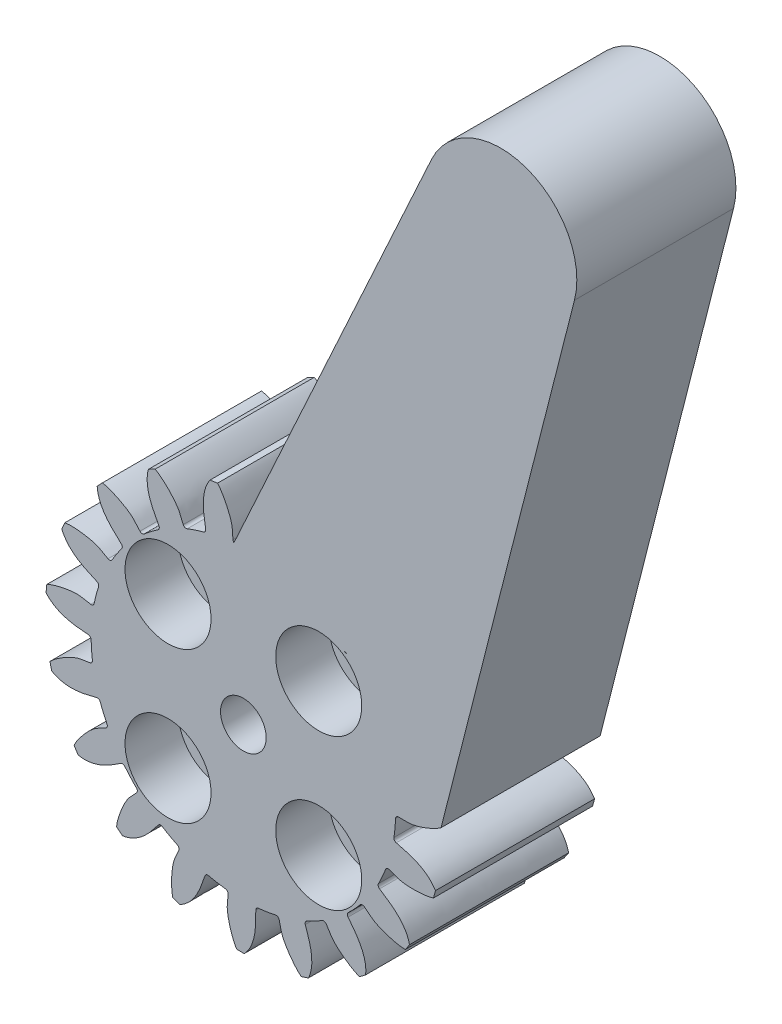
from build123d import *

# Parameters (mm, degrees)
SKETCH_3_R               = 13
SKETCH_3_R_2             = 10
EXTRUDE_1_DEPTH          = 4
CUT_EXTRUDE_2_DEPTH      = 19.814887722
PATTERN_CIRCULAR_4_COUNT = 19
CUT_EXTRUDE_4_DEPTH      = 19.804447773
CUT_EXTRUDE_4_DEPTH_BACK = 19.804447773
SKETCH_8_R               = 1.5
SKETCH_13_R              = 1.5
EXTRUDE_6_DEPTH          = 6.45
SKETCH_14_R              = 2.825
CUT_EXTRUDE_5_DEPTH      = 3.5
EXTRUDE_7_DEPTH          = 10.45


with BuildPart() as part:
    # 草图3 → 凸台-拉伸1 (new body)
    # profile 1 of 2: a face of its own
    with BuildSketch(Plane.XY):
        Circle(SKETCH_3_R)
        Circle(SKETCH_3_R_2, mode=Mode.SUBTRACT)
    # profile 2 of 2: a face of its own
    with BuildSketch(Plane.XY):
        Circle(SKETCH_3_R_2)
    extrude(amount=EXTRUDE_1_DEPTH)

    # 草图6 → 切除-拉伸2 (cut, symmetric)
    with BuildSketch(Plane.XY.offset(4)):
        with BuildLine():
            Line((-1.696840499, 12.888783198), (-1.873622587, 14.231576474))
            Line((-1.873622587, 14.231576474), (3.000861464, 14.403965519))
            Line((3.000861464, 14.403965519), (2.084995297, 12.83171051))
            add(Edge.make_bspline(
                [(2.084995297, 12.83171051), (1.471750903, 12.385409064), (1.073531879, 11.424223458), (0.908091171, 10.424013275), (0.866775265, 10.148389403)],
                knots=[0, 0, 0, 0, 0.67611985, 0.94077492, 0.94077492, 0.94077492, 0.94077492], degree=3))
            ThreePointArc((0.866775265, 10.148389403), (0.794461275, 10.022295574), (0.655867727, 9.978468696))
            ThreePointArc((0.655867727, 9.978468696), (0.089873577, 9.999596129), (-0.476408885, 9.988645282))
            ThreePointArc((-0.476408885, 9.988645282), (-0.618800498, 10.03892803), (-0.685447576, 10.174434093))
            add(Edge.make_bspline(
                [(-1.696840499, 12.888783198), (-1.34037548, 12.491366053), (-0.721854022, 11.223575025), (-0.721476087, 10.688451407), (-0.685447576, 10.174434093)],
                knots=[0, 0, 0, 0, 0.6442443, 0.94077492, 0.94077492, 0.94077492, 0.94077492], degree=3))
        make_face()
    cut_extrude_2 = extrude(amount=CUT_EXTRUDE_2_DEPTH, both=True, mode=Mode.SUBTRACT)

    # 阵列(圆周)4: 切除-拉伸2 ×19 about axis
    pattern_circular_4_axis = Axis((0, 0, 4), (0, 0, 1))
    for i in range(1, PATTERN_CIRCULAR_4_COUNT):
        add(cut_extrude_2.rotate(pattern_circular_4_axis, i * 360 / PATTERN_CIRCULAR_4_COUNT), mode=Mode.SUBTRACT)

    # 草图8 → 切除-拉伸4 (cut, two sides: drawn at the far end of the back side and taken through both)
    with BuildSketch(Plane(origin=(0, 0, 0), x_dir=(-1, 0, 0), z_dir=(0, 0, -1)).offset(-CUT_EXTRUDE_4_DEPTH_BACK)):
        Circle(SKETCH_8_R)
        with Locations((-4.949747468, 4.949747468)):
            Circle(SKETCH_8_R)
        with Locations((-4.949747468, -4.949747468)):
            Circle(SKETCH_8_R)
        with Locations((4.949747468, -4.949747468)):
            Circle(SKETCH_8_R)
        with Locations((4.949747468, 4.949747468)):
            Circle(SKETCH_8_R)
    extrude(amount=CUT_EXTRUDE_4_DEPTH + CUT_EXTRUDE_4_DEPTH_BACK, mode=Mode.SUBTRACT)

    # 草图13 → 凸台-拉伸6 (add)
    with BuildSketch(Plane(origin=(0, 0, 0), x_dir=(-1, 0, 0), z_dir=(0, 0, -1))):
        with BuildLine():
            ThreePointArc((2.475365662, 9.879963141), (2.502818882, 9.73722111), (2.619672484, 9.650767642))
            ThreePointArc((2.619672484, 9.650767642), (3.161859577, 9.486972331), (3.693903558, 9.292743217))
            ThreePointArc((3.693903558, 9.292743217), (3.844906783, 9.294067025), (3.951941485, 9.400590726))
            add(Edge.make_bspline(
                [(5.789882063, 11.639470164), (5.323690166, 11.379330179), (4.327030833, 10.381065154), (4.152919021, 9.875058725), (3.951941485, 9.400590726)],
                knots=[0, 0, 0, 0, 0.6442443, 0.94077492, 0.94077492, 0.94077492, 0.94077492], degree=3))
            ThreePointArc((5.789882063, 11.639470164), (6.014090471, 11.525220857), (6.23604547, 11.406653186))
            add(Edge.make_bspline(
                [(5.54926231, 8.540889569), (5.685949941, 8.783772287), (6.169735786, 9.674694447), (6.445857441, 10.677796132), (6.23604547, 11.406653186)],
                knots=[0, 0, 0, 0, 0.26465507, 0.94077492, 0.94077492, 0.94077492, 0.94077492], degree=3))
            ThreePointArc((5.54926231, 8.540889569), (5.528879777, 8.39696765), (5.611330534, 8.277256166))
            ThreePointArc((5.611330534, 8.277256166), (6.070956184, 7.946287876), (6.511106465, 7.589828233))
            ThreePointArc((6.511106465, 7.589828233), (6.654357758, 7.542049646), (6.790181214, 7.608047488))
            add(Edge.make_bspline(
                [(9.255500067, 9.128839932), (8.730100418, 9.034167311), (7.463306713, 8.413605795), (7.13432874, 7.991550203), (6.790181214, 7.608047488)],
                knots=[0, 0, 0, 0, 0.6442443, 0.94077492, 0.94077492, 0.94077492, 0.94077492], degree=3))
            ThreePointArc((9.255500067, 9.128839932), (9.430463555, 8.947980617), (9.60189356, 8.763768599))
            add(Edge.make_bspline(
                [(8.021810282, 6.276278088), (8.229955689, 6.461618348), (8.976810635, 7.147182881), (9.563677842, 8.006277195), (9.60189356, 8.763768599)],
                knots=[0, 0, 0, 0, 0.26465507, 0.94077492, 0.94077492, 0.94077492, 0.94077492], degree=3))
            ThreePointArc((8.021810282, 6.276278088), (7.955800759, 6.146772452), (7.994913852, 6.00677555))
            ThreePointArc((7.994913852, 6.00677555), (8.322170488, 5.54449983), (8.622729956, 5.064437591))
            ThreePointArc((8.622729956, 5.064437591), (8.742705817, 4.972734162), (8.892599447, 4.991054254))
            add(Edge.make_bspline(
                [(11.718141024, 5.628958246), (11.190468827, 5.710012235), (9.790817505, 5.534401698), (9.342623239, 5.242033215), (8.892599447, 4.991054254)],
                knots=[0, 0, 0, 0, 0.6442443, 0.94077492, 0.94077492, 0.94077492, 0.94077492], degree=3))
            ThreePointArc((11.718141024, 5.628958246), (11.824899585, 5.401087836), (11.927227495, 5.171193701))
            add(Edge.make_bspline(
                [(9.625070638, 3.331534489), (9.882118037, 3.439247799), (10.811108762, 3.84516315), (11.645125353, 4.467153894), (11.927227495, 5.171193701)],
                knots=[0, 0, 0, 0, 0.26465507, 0.94077492, 0.94077492, 0.94077492, 0.94077492], degree=3))
            ThreePointArc((9.625070638, 3.331534489), (9.520587282, 3.230479082), (9.512124199, 3.085367598))
            ThreePointArc((9.512124199, 3.085367598), (9.671548488, 2.541879196), (9.79994686, 1.990236553))
            ThreePointArc((9.79994686, 1.990236553), (9.883646043, 1.86454577), (10.031366548, 1.833202847))
            add(Edge.make_bspline(
                [(12.910939576, 1.519091591), (12.438176302, 1.767088734), (11.0573413, 2.055459301), (10.538499545, 1.924460589), (10.031366548, 1.833202847)],
                knots=[0, 0, 0, 0, 0.6442443, 0.94077492, 0.94077492, 0.94077492, 0.94077492], degree=3))
            ThreePointArc((12.910939576, 1.519091591), (12.937924262, 1.26890338), (12.96006126, 1.018239726))
            add(Edge.make_bspline(
                [(10.185305242, 0.025767433), (10.463399559, 0.044181386), (11.473855503, 0.126460328), (12.464642839, 0.443945154), (12.96006126, 1.018239726)],
                knots=[0, 0, 0, 0, 0.26465507, 0.94077492, 0.94077492, 0.94077492, 0.94077492], degree=3))
            ThreePointArc((10.185305242, 0.025767433), (10.053670446, -0.035886822), (9.998548294, -0.170387807))
            ThreePointArc((9.998548294, -0.170387807), (9.972864139, -0.736193491), (9.915187461, -1.299637496))
            ThreePointArc((9.915187461, -1.299637496), (9.953539861, -1.445695087), (10.08307943, -1.523304533))
            add(Edge.make_bspline(
                [(12.704637491, -2.755392209), (12.338014375, -2.367326251), (11.125630593, -1.646224004), (10.592365903, -1.601657202), (10.08307943, -1.523304533)],
                knots=[0, 0, 0, 0, 0.6442443, 0.94077492, 0.94077492, 0.94077492, 0.94077492], degree=3))
            ThreePointArc((12.704637491, -2.755392209), (12.648924093, -3.000786445), (12.588471292, -3.245056323))
            add(Edge.make_bspline(
                [(9.641803982, -3.282791923), (9.910809382, -3.355672766), (10.893231964, -3.605946433), (11.933422864, -3.627371933), (12.588471292, -3.245056323)],
                knots=[0, 0, 0, 0, 0.26465507, 0.94077492, 0.94077492, 0.94077492, 0.94077492], degree=3))
            ThreePointArc((9.641803982, -3.282791923), (9.497282418, -3.298363832), (9.401474538, -3.40767905))
            ThreePointArc((9.401474538, -3.40767905), (9.193465217, -3.934488189), (8.95596365, -4.448675658))
            ThreePointArc((8.95596365, -4.448675658), (8.944813189, -4.599272449), (9.042134201, -4.714738231))
            add(Edge.make_bspline(
                [(11.121590801, -6.731286508), (10.900837147, -6.245204703), (9.988285179, -5.169513395), (9.498385058, -4.954210583), (9.042134201, -4.714738231)],
                knots=[0, 0, 0, 0, 0.6442443, 0.94077492, 0.94077492, 0.94077492, 0.94077492], degree=3))
            ThreePointArc((11.121590801, -6.731286508), (10.98921673, -6.945294498), (10.852725129, -7.156700167))
            add(Edge.make_bspline(
                [(8.053463652, -6.235609836), (8.284229227, -6.391887706), (9.132157717, -6.947592946), (10.109031356, -7.305606986), (10.852725129, -7.156700167)],
                knots=[0, 0, 0, 0, 0.26465507, 0.94077492, 0.94077492, 0.94077492, 0.94077492], degree=3))
            ThreePointArc((8.053463652, -6.235609836), (7.911716475, -6.203411942), (7.785605137, -6.275695392))
            ThreePointArc((7.785605137, -6.275695392), (7.417811686, -6.706420043), (7.026222211, -7.115630783))
            ThreePointArc((7.026222211, -7.115630783), (6.966777215, -7.254447276), (7.021333428, -7.395256884))
            add(Edge.make_bspline(
                [(8.333347178, -9.977741468), (8.282385071, -9.446318322), (7.768554082, -8.132605796), (7.37510681, -7.769898375), (7.021333428, -7.395256884)],
                knots=[0, 0, 0, 0, 0.6442443, 0.94077492, 0.94077492, 0.94077492, 0.94077492], degree=3))
            ThreePointArc((8.333347178, -9.977741468), (8.138657219, -10.137172124), (7.940917801, -10.2928045))
            add(Edge.make_bspline(
                [(5.592405573, -8.512702669), (5.759924291, -8.735442432), (6.381472481, -9.53635996), (7.189169443, -10.192166164), (7.940917801, -10.2928045)],
                knots=[0, 0, 0, 0, 0.26465507, 0.94077492, 0.94077492, 0.94077492, 0.94077492], degree=3))
            ThreePointArc((5.592405573, -8.512702669), (5.468793288, -8.436224112), (5.326044613, -8.463642761))
            ThreePointArc((5.326044613, -8.463642761), (4.838323161, -8.751607223), (4.335080573, -9.011496903))
            ThreePointArc((4.335080573, -9.011496903), (4.233782829, -9.123490176), (4.239662231, -9.274384705))
            add(Edge.make_bspline(
                [(4.642056084, -12.142953319), (4.766408057, -11.623776776), (4.706979609, -10.214404169), (4.452621302, -9.743597116), (4.239662231, -9.274384705)],
                knots=[0, 0, 0, 0, 0.6442443, 0.94077492, 0.94077492, 0.94077492, 0.94077492], degree=3))
            ThreePointArc((4.642056084, -12.142953319), (4.406147914, -12.230529856), (4.168588813, -12.313523757))
            add(Edge.make_bspline(
                [(2.525323576, -9.867312079), (2.611442185, -10.132376426), (2.939255683, -11.0917144), (3.490249469, -11.97424599), (4.168588813, -12.313523757)],
                knots=[0, 0, 0, 0, 0.26465507, 0.94077492, 0.94077492, 0.94077492, 0.94077492], degree=3))
            ThreePointArc((2.525323576, -9.867312079), (2.433241492, -9.754840498), (2.289324513, -9.734423109))
            ThreePointArc((2.289324513, -9.734423109), (1.734527246, -9.848421967), (1.174165689, -9.930827505))
            ThreePointArc((1.174165689, -9.930827505), (1.04199238, -10.00386135), (0.998557846, -10.148489036))
            add(Edge.make_bspline(
                [(0.447726184, -12.992287761), (0.733916772, -12.541618654), (1.135330859, -11.189313357), (1.047625186, -10.661425922), (0.998557846, -10.148489036)],
                knots=[0, 0, 0, 0, 0.6442443, 0.94077492, 0.94077492, 0.94077492, 0.94077492], degree=3))
            ThreePointArc((0.447726184, -12.992287761), (0.196164114, -12.998519902), (-0.055471455, -12.99988165))
            add(Edge.make_bspline(
                [(-0.815416416, -10.152645118), (-0.820030203, -10.431310214), (-0.821475076, -11.44510948), (-0.586893191, -12.458730464), (-0.055471455, -12.99988165)],
                knots=[0, 0, 0, 0, 0.26465507, 0.94077492, 0.94077492, 0.94077492, 0.94077492], degree=3))
            ThreePointArc((-0.815416416, -10.152645118), (-0.865989775, -10.016368554), (-0.99547942, -9.950327669))
            ThreePointArc((-0.99547942, -9.950327669), (-1.55723161, -9.878007376), (-2.113988266, -9.773998855))
            ThreePointArc((-2.113988266, -9.773998855), (-2.262714112, -9.800158922), (-2.350755776, -9.922847111))
            add(Edge.make_bspline(
                [(-3.795121796, -12.433706228), (-3.378105783, -12.100381549), (-2.559348607, -10.951686823), (-2.470897374, -10.4239238), (-2.350755776, -9.922847111)],
                knots=[0, 0, 0, 0, 0.6442443, 0.94077492, 0.94077492, 0.94077492, 0.94077492], degree=3))
            ThreePointArc((-3.795121796, -12.433706228), (-4.035077111, -12.357918624), (-4.27352053, -12.277500653))
            add(Edge.make_bspline(
                [(-4.067793386, -9.337781524), (-4.162639595, -9.599849683), (-4.493186263, -10.558249358), (-4.600436868, -11.593118175), (-4.27352053, -12.277500653)],
                knots=[0, 0, 0, 0, 0.26465507, 0.94077492, 0.94077492, 0.94077492, 0.94077492], degree=3))
            ThreePointArc((-4.067793386, -9.337781524), (-4.071377613, -9.192467657), (-4.172407712, -9.087959831))
            ThreePointArc((-4.172407712, -9.087959831), (-4.680240257, -8.837157412), (-5.173058791, -8.558005769))
            ThreePointArc((-5.173058791, -8.558005769), (-5.32222042, -8.534457208), (-5.445328533, -8.621910731))
            add(Edge.make_bspline(
                [(-7.626709441, -10.527739696), (-7.12405816, -10.347880345), (-5.976682938, -9.527275089), (-5.721659864, -9.05682779), (-5.445328533, -8.621910731)],
                knots=[0, 0, 0, 0, 0.6442443, 0.94077492, 0.94077492, 0.94077492, 0.94077492], degree=3))
            ThreePointArc((-7.626709441, -10.527739696), (-7.829055121, -10.37814511), (-8.028467345, -10.224661955))
            add(Edge.make_bspline(
                [(-6.879361825, -7.511024412), (-7.054162396, -7.728096481), (-7.677991, -8.52723909), (-8.115451827, -9.471211646), (-8.028467345, -10.224661955)],
                knots=[0, 0, 0, 0, 0.26465507, 0.94077492, 0.94077492, 0.94077492, 0.94077492], degree=3))
            ThreePointArc((-6.879361825, -7.511024412), (-6.835568513, -7.372420254), (-6.897190887, -7.24077053))
            ThreePointArc((-6.897190887, -7.24077053), (-7.296072252, -6.838664321), (-7.671548128, -6.414619967))
            ThreePointArc((-7.671548128, -6.414619967), (-7.804981563, -6.343914631), (-7.949815452, -6.386656542))
            add(Edge.make_bspline(
                [(-10.631824778, -7.480929213), (-10.098008294, -7.474025743), (-8.746350935, -7.070435268), (-8.352391726, -6.708283958), (-7.949815452, -6.386656542)],
                knots=[0, 0, 0, 0, 0.6442443, 0.94077492, 0.94077492, 0.94077492, 0.94077492], degree=3))
            ThreePointArc((-10.631824778, -7.480929213), (-10.774633528, -7.27373854), (-10.913405149, -7.063822482))
            add(Edge.make_bspline(
                [(-8.945444665, -4.870331258), (-9.181257245, -5.018884111), (-10.030766276, -5.572170153), (-10.751031656, -6.322952374), (-10.913405149, -7.063822482)],
                knots=[0, 0, 0, 0, 0.26465507, 0.94077492, 0.94077492, 0.94077492, 0.94077492], degree=3))
            ThreePointArc((-8.945444665, -4.870331258), (-8.8590195, -4.753456721), (-8.874556408, -4.608931391))
            ThreePointArc((-8.874556408, -4.608931391), (-9.121261608, -4.099095838), (-9.338706188, -3.576110559))
            ThreePointArc((-9.338706188, -3.576110559), (-9.441951847, -3.465910467), (-9.592816512, -3.459309017))
            add(Edge.make_bspline(
                [(-12.48481693, -3.623443971), (-11.977682543, -3.790244479), (-10.568216095, -3.847404077), (-10.078012345, -3.63279347), (-9.592816512, -3.459309017)],
                knots=[0, 0, 0, 0, 0.6442443, 0.94077492, 0.94077492, 0.94077492, 0.94077492], degree=3))
            ThreePointArc((-12.48481693, -3.623443971), (-12.552613207, -3.381109535), (-12.615706166, -3.137508236))
            add(Edge.make_bspline(
                [(-10.042149774, -1.701862142), (-10.31342041, -1.765797772), (-11.296552383, -2.013270119), (-12.221570386, -2.489503102), (-12.615706166, -3.137508236)],
                knots=[0, 0, 0, 0, 0.26465507, 0.94077492, 0.94077492, 0.94077492, 0.94077492], degree=3))
            ThreePointArc((-10.042149774, -1.701862142), (-9.922458262, -1.619382395), (-9.890226039, -1.47764302))
            ThreePointArc((-9.890226039, -1.47764302), (-9.958020737, -0.915326716), (-9.993870528, -0.350074083))
            ThreePointArc((-9.993870528, -0.350074083), (-10.055740141, -0.212321125), (-10.196287055, -0.157091683))
            add(Edge.make_bspline(
                [(-12.984885446, 0.626697648), (-12.559389035, 0.304268585), (-11.244851058, -0.207446955), (-10.711523949, -0.16363344), (-10.196287055, -0.157091683)],
                knots=[0, 0, 0, 0, 0.6442443, 0.94077492, 0.94077492, 0.94077492, 0.94077492], degree=3))
            ThreePointArc((-12.984885446, 0.626697648), (-12.97032247, 0.877915151), (-12.950899667, 1.12880371))
            add(Edge.make_bspline(
                [(-10.050632134, 1.651030144), (-10.327964444, 1.678640154), (-11.338181754, 1.763798972), (-12.367712328, 1.61372246), (-12.950899667, 1.12880371)],
                knots=[0, 0, 0, 0, 0.26465507, 0.94077492, 0.94077492, 0.94077492, 0.94077492], degree=3))
            ThreePointArc((-10.050632134, 1.651030144), (-9.910644708, 1.69017714), (-9.834136216, 1.8137709))
            ThreePointArc((-9.834136216, 1.8137709), (-9.715673805, 2.367632258), (-9.566043926, 2.913898353))
            ThreePointArc((-9.566043926, 2.913898353), (-9.57983296, 3.064276505), (-9.694831684, 3.162148972))
            add(Edge.make_bspline(
                [(-12.077840143, 4.808926853), (-11.780090846, 4.365809427), (-10.702931927, 3.454990263), (-10.184275727, 3.323258811), (-9.694831684, 3.162148972)],
                knots=[0, 0, 0, 0, 0.6442443, 0.94077492, 0.94077492, 0.94077492, 0.94077492], degree=3))
            ThreePointArc((-12.077840143, 4.808926853), (-11.982496039, 5.041804108), (-11.882662235, 5.272792259))
            add(Edge.make_bspline(
                [(-8.969972551, 4.825007696), (-9.223313276, 4.941171373), (-10.151143203, 5.349733076), (-11.173620733, 5.542076154), (-11.882662235, 5.272792259)],
                knots=[0, 0, 0, 0, 0.26465507, 0.94077492, 0.94077492, 0.94077492, 0.94077492], degree=3))
            ThreePointArc((-8.969972551, 4.825007696), (-8.824859021, 4.816579757), (-8.712365142, 4.908634599))
            ThreePointArc((-8.712365142, 4.908634599), (-8.420482862, 5.394021539), (-8.101588032, 5.862104687))
            ThreePointArc((-8.101588032, 5.862104687), (-8.065802231, 6.008812229), (-8.142790869, 6.138721721))
            add(Edge.make_bspline(
                [(-9.861973453, 8.470034215), (-9.724237028, 7.954247075), (-9.001184049, 6.743025677), (-8.553403205, 6.450024405), (-8.142790869, 6.138721721)],
                knots=[0, 0, 0, 0, 0.6442443, 0.94077492, 0.94077492, 0.94077492, 0.94077492], degree=3))
            ThreePointArc((-9.861973453, 8.470034215), (-9.696180235, 8.659335359), (-9.526753972, 8.845391951))
            add(Edge.make_bspline(
                [(-6.917277258, 7.476120796), (-7.119173, 7.668250004), (-7.864070774, 8.355940591), (-8.768693956, 8.869859903), (-9.526753972, 8.845391951)],
                knots=[0, 0, 0, 0, 0.26465507, 0.94077492, 0.94077492, 0.94077492, 0.94077492], degree=3))
            ThreePointArc((-6.917277258, 7.476120796), (-6.782762927, 7.42103122), (-6.646474119, 7.471571574))
            ThreePointArc((-6.646474119, 7.471571574), (-6.212801944, 7.83588489), (-5.759199365, 8.17506102))
            ThreePointArc((-5.759199365, 8.17506102), (-5.677716677, 8.302199912), (-5.708352315, 8.450068718))
            add(Edge.make_bspline(
                [(-6.577408916, 11.213281944), (-6.61461124, 10.68071863), (-6.324018211, 9.300349629), (-5.995636726, 8.877829772), (-5.708352315, 8.450068718)],
                knots=[0, 0, 0, 0, 0.6442443, 0.94077492, 0.94077492, 0.94077492, 0.94077492], degree=3))
            ThreePointArc((-6.577408916, 11.213281944), (-6.35913285, 11.338493259), (-6.138474093, 11.459456174))
            add(Edge.make_bspline(
                [(-4.114987643, 9.317080204), (-4.243559864, 9.564354762), (-4.724804254, 10.456652288), (-5.413543129, 11.236456701), (-6.138474093, 11.459456174)],
                knots=[0, 0, 0, 0, 0.26465507, 0.94077492, 0.94077492, 0.94077492, 0.94077492], degree=3))
            ThreePointArc((-4.114987643, 9.317080204), (-4.005649225, 9.221298802), (-3.860334494, 9.224847836))
            ThreePointArc((-3.860334494, 9.224847836), (-3.331867534, 9.428608526), (-2.792712084, 9.602122641))
            ThreePointArc((-2.792712084, 9.602122641), (-2.674362422, 9.695915412), (-2.655325214, 9.845719654))
            add(Edge.make_bspline(
                [(-2.580080063, 12.741396582), (-2.788189688, 12.249768592), (-2.961546873, 10.84983639), (-2.788149975, 10.34358453), (-2.655325214, 9.845719654)],
                knots=[0, 0, 0, 0, 0.6442443, 0.94077492, 0.94077492, 0.94077492, 0.94077492], degree=3))
            ThreePointArc((-2.580080063, 12.741396582), (-2.332974749, 12.788949481), (-2.084995297, 12.83171051))
            add(Edge.make_bspline(
                [(-0.866775265, 10.148389403), (-0.908091171, 10.424013275), (-1.073531879, 11.424223458), (-1.471750903, 12.385409064), (-2.084995297, 12.83171051)],
                knots=[0, 0, 0, 0, 0.26465507, 0.94077492, 0.94077492, 0.94077492, 0.94077492], degree=3))
            ThreePointArc((-0.866775265, 10.148389403), (-0.794461275, 10.022295574), (-0.655867727, 9.978468696))
            ThreePointArc((-0.655867727, 9.978468696), (-0.089873577, 9.999596129), (0.476408885, 9.988645282))
            ThreePointArc((0.476408885, 9.988645282), (0.618800498, 10.03892803), (0.685447576, 10.174434093))
            add(Edge.make_bspline(
                [(1.696840499, 12.888783198), (1.34037548, 12.491366053), (0.721854022, 11.223575025), (0.721476087, 10.688451407), (0.685447576, 10.174434093)],
                knots=[0, 0, 0, 0, 0.6442443, 0.94077492, 0.94077492, 0.94077492, 0.94077492], degree=3))
            ThreePointArc((1.696840499, 12.888783198), (1.945997366, 12.853524585), (2.194425091, 12.813449907))
            add(Edge.make_bspline(
                [(2.475365662, 9.879963141), (2.525783291, 10.154068204), (2.694074332, 11.153802751), (2.629528369, 12.192210175), (2.194425091, 12.813449907)],
                knots=[0, 0, 0, 0, 0.26465507, 0.94077492, 0.94077492, 0.94077492, 0.94077492], degree=3))
        make_face()
        with Locations((-4.949747468, -4.949747468)):
            Circle(SKETCH_13_R, mode=Mode.SUBTRACT)
        with Locations((4.949747468, -4.949747468)):
            Circle(SKETCH_13_R, mode=Mode.SUBTRACT)
        with Locations((4.949747468, 4.949747468)):
            Circle(SKETCH_13_R, mode=Mode.SUBTRACT)
        Circle(SKETCH_13_R, mode=Mode.SUBTRACT)
        with Locations((-4.949747468, 4.949747468)):
            Circle(SKETCH_13_R, mode=Mode.SUBTRACT)
    extrude(amount=EXTRUDE_6_DEPTH)

    # 草图14 → 切除-拉伸5 (cut)
    with BuildSketch(Plane.XY.offset(4)):
        with Locations((4.949747468, -4.949747468)):
            Circle(SKETCH_14_R)
        with Locations((-4.949747468, -4.949747468)):
            Circle(SKETCH_14_R)
        with Locations((-4.949747468, 4.949747468)):
            Circle(SKETCH_14_R)
        with Locations((4.949747468, 4.949747468)):
            Circle(SKETCH_14_R)
    extrude(amount=-CUT_EXTRUDE_5_DEPTH, mode=Mode.SUBTRACT)

    # 草图15 → 凸台-拉伸7 (add)
    with BuildSketch(Plane(origin=(0, 0, -6.45), x_dir=(-1, 0, 0), z_dir=(0, 0, -1))):
        with BuildLine():
            Line((-21.749847401, 35.017466583), (-12.984885446, 0.626697648))
            Line((-12.984885446, 0.626697648), (-10.846258118, 1.042234649))
            Line((-10.846258118, 1.042234649), (-9.591718309, 1.684803819))
            Line((-9.591718309, 1.684803819), (-8.985227143, 3.564926432))
            Line((-8.985227143, 3.564926432), (-8.122988776, 5.387226183))
            Line((-8.122988776, 5.387226183), (-7.275822133, 7.177672561))
            Line((-7.275822133, 7.177672561), (-5.496849024, 8.08885391))
            Line((-5.496849024, 8.08885391), (-4.351091177, 8.67570549))
            Line((-4.351091177, 8.67570549), (-2.317341439, 9.717382185))
            Line((-2.317341439, 9.717382185), (-0.687545515, 9.717382185))
            Line((-0.687545515, 9.717382185), (0.35280457, 9.717382185))
            Line((0.35280457, 9.717382185), (0.618800498, 10.03892803))
            Line((0.618800498, 10.03892803), (-12.359948272, 38.336766992))
            ThreePointArc((-12.359948272, 38.336766992), (-18.571160498, 40.966440347), (-21.749847401, 35.017466583))
        make_face()
    extrude(amount=-EXTRUDE_7_DEPTH)


solid = part.part
